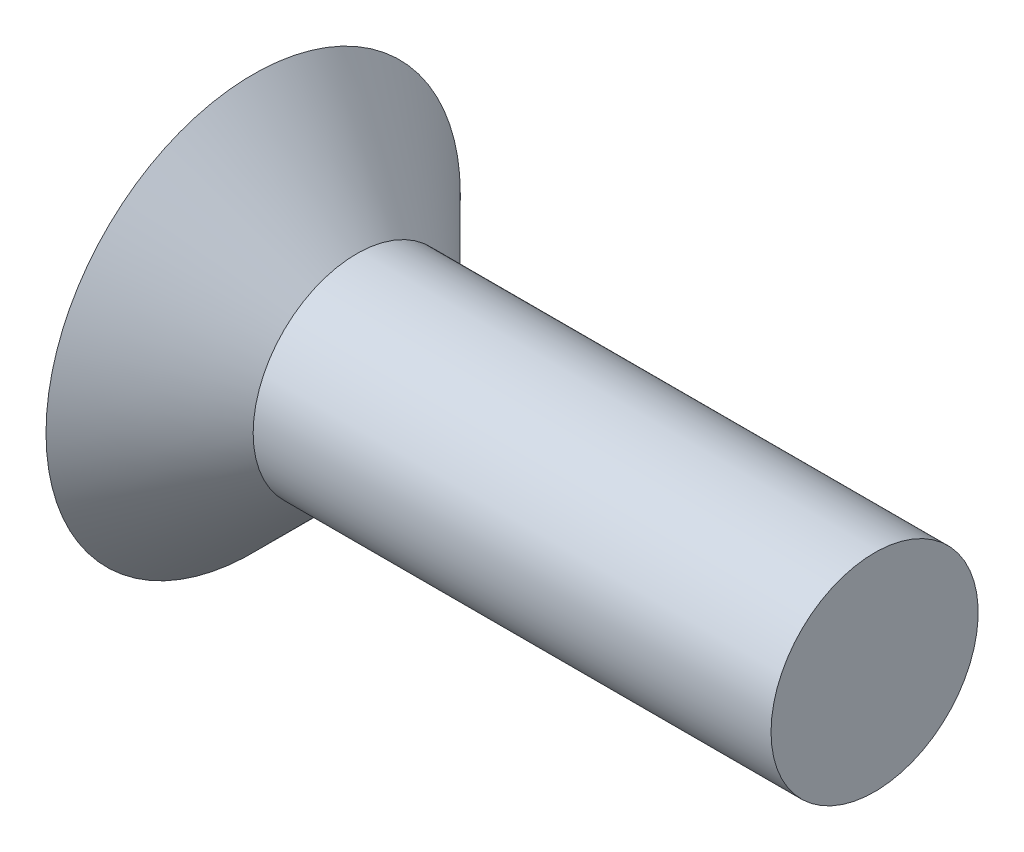
from build123d import *


with BuildPart() as part:
    # 草图1 → 旋转3 (revolve)
    with BuildSketch(Plane(origin=(0, 0, 0), x_dir=(1, 0, 0), z_dir=(0, 1, 0)), mode=Mode.PRIVATE) as revolve_3_sk:
        Polygon((-15.305092913, 0), (-6.305092913, 0), (-6.305092913, 1.5), (-13.805092913, 1.5), (-15.305092913, 3), align=None)
    revolve(revolve_3_sk.sketch.rotate(Axis((-15.305092913, 0, 0), (1, 0, 0)), 180), axis=Axis((-15.305092913, 0, 0), (1, 0, 0)))


solid = part.part
